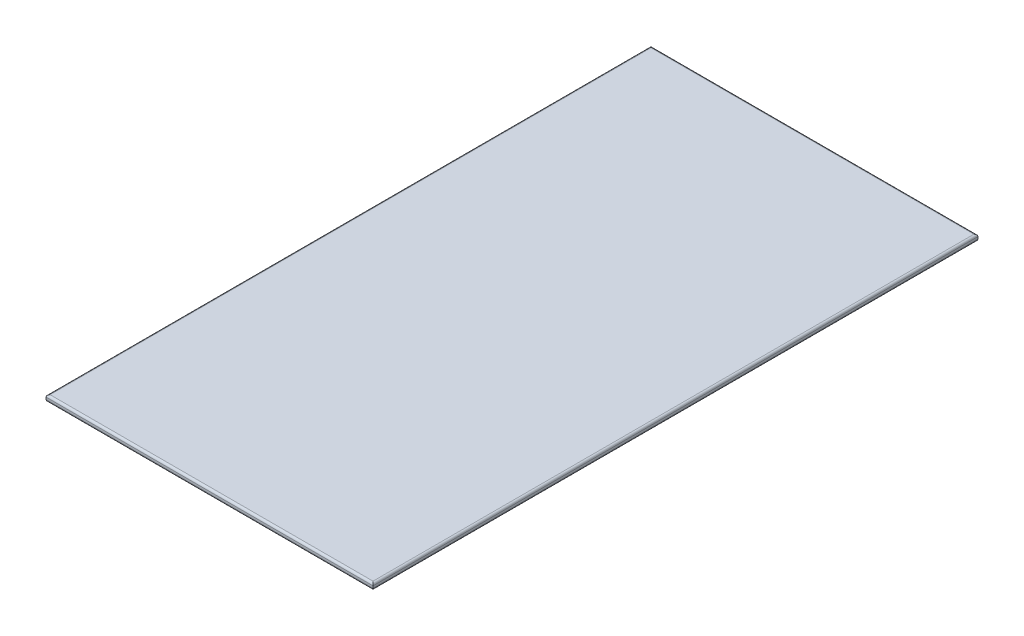
from build123d import *

# Parameters (mm, degrees)
SKETCH1_W           = 160
SKETCH1_H           = 296
BOSS_EXTRUDE1_DEPTH = 3
FILLET1_R           = 1


with BuildPart() as part:
    # Sketch1 → Boss-Extrude1 (new body)
    with BuildSketch(Plane(origin=(0, 0, 0), x_dir=(1, 0, 0), z_dir=(0, 1, 0))):
        Rectangle(SKETCH1_W, SKETCH1_H)
    extrude(amount=BOSS_EXTRUDE1_DEPTH)

    # Fillet1
    fillet1_edges = [part.edges().sort_by_distance(p)[0] for p in [
        (-80, 3, 0),
        (0, 3, 148),
        (80, 3, 0),
        (0, 0, 148),
        (-80, 0, 0),
        (0, 0, -148),
        (80, 0, 0),
        (0, 3, -148),
    ]]
    fillet(fillet1_edges, radius=FILLET1_R)


solid = part.part
